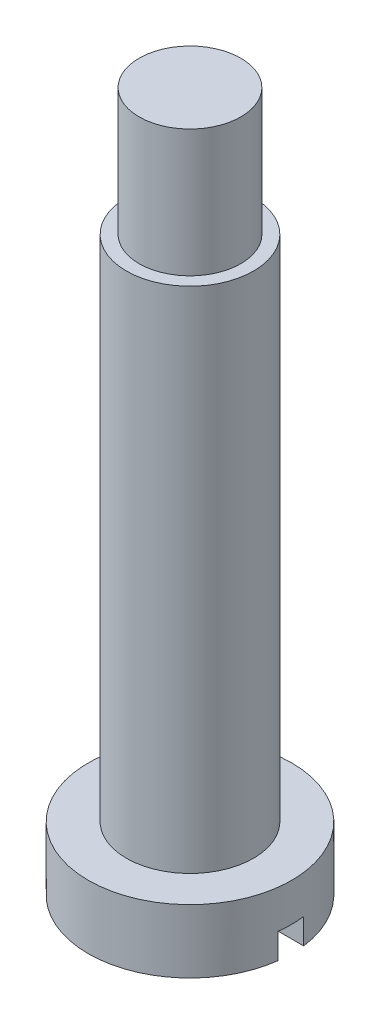
from build123d import *

# Parameters (mm, degrees)
SKETCH_1_R               = 4
EXTRUDE_1_DEPTH          = 2.5
SKETCH_2_R               = 2.5
EXTRUDE_2_DEPTH          = 20
SKETCH_3_R               = 2
EXTRUDE_3_DEPTH          = 5
CUT_EXTRUDE_1_DEPTH      = 29.075790283
CUT_EXTRUDE_1_DEPTH_BACK = 1
SKETCH_4_W               = 8
SKETCH_4_H               = 1


with BuildPart() as part:
    # 草图1 → 凸台-拉伸1 (new body)
    with BuildSketch(Plane(origin=(0, 0, 0), x_dir=(1, 0, 0), z_dir=(0, 1, 0))):
        Circle(SKETCH_1_R)
    extrude(amount=-EXTRUDE_1_DEPTH)

    # 草图2 → 凸台-拉伸2 (add)
    with BuildSketch(Plane(origin=(0, 0, 0), x_dir=(1, 0, 0), z_dir=(0, 1, 0))):
        Circle(SKETCH_2_R)
    extrude(amount=EXTRUDE_2_DEPTH)

    # 草图3 → 凸台-拉伸3 (add)
    with BuildSketch(Plane(origin=(0, 20, 0), x_dir=(1, 0, 0), z_dir=(0, 1, 0))):
        Circle(SKETCH_3_R)
    extrude(amount=EXTRUDE_3_DEPTH)

    # 草图4 → 切除-拉伸-薄壁1 (cut, two sides: drawn at the far end of the back side and taken through both)
    with BuildSketch(Plane.XZ.offset(2.5).offset(-CUT_EXTRUDE_1_DEPTH_BACK)):
        Rectangle(SKETCH_4_W, SKETCH_4_H)
    extrude(amount=CUT_EXTRUDE_1_DEPTH + CUT_EXTRUDE_1_DEPTH_BACK, mode=Mode.SUBTRACT)


solid = part.part
